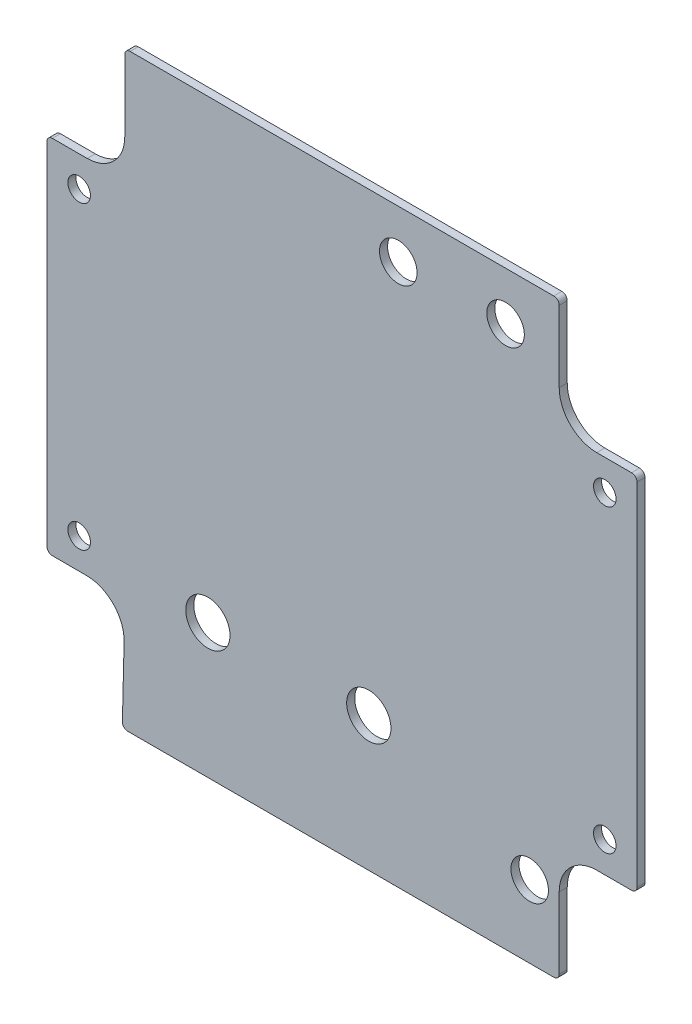
from build123d import *

# Parameters (mm, degrees)
EXTRUDE_1_DEPTH     = 1.5
HOLE_WIZARD_M4_1_D  = 4.2
HOLE_WIZARD_M8_1_D  = 8.25
SKETCH_8_R          = 3.5
CUT_EXTRUDE_1_DEPTH = 144.323608762
SKETCH_9_R          = 3.5
CUT_EXTRUDE_2_DEPTH = 144.323608762


with BuildPart() as part:
    # 草圖1 → 填料-伸長1 (new body)
    with BuildSketch(Plane.XY):
        with BuildLine():
            Line((9.519190028, -18.946187519), (9.519190028, -5.659090909))
            ThreePointArc((9.519190028, -5.659090909), (9.226296809, -4.951984128), (8.519190028, -4.659090909))
            Line((8.519190028, -4.659090909), (-70.48081017, -4.659090909))
            ThreePointArc((-70.48081017, -4.659090909), (-71.187916951, -4.951984128), (-71.48081017, -5.659090909))
            Line((-71.48081017, -5.659090909), (-71.48081017, -18.946187519))
            ThreePointArc((-71.48081017, -18.946187519), (-73.531062702, -23.895934988), (-78.48081017, -25.946187519))
            Line((-78.48081017, -25.946187519), (-84.980810071, -25.946187519))
            ThreePointArc((-84.980810071, -25.946187519), (-85.687916853, -26.239080738), (-85.980810071, -26.946187519))
            Line((-85.980810071, -26.946187519), (-85.980810071, -92.341911374))
            ThreePointArc((-85.980810071, -92.341911374), (-85.688840793, -93.048093006), (-84.983425077, -93.341907955))
            Line((-84.983425077, -93.341907955), (-78.583599692, -93.358643592))
            ThreePointArc((-78.583599692, -93.358643592), (-73.586751521, -95.475153852), (-71.603919064, -100.526538095))
            Line((-71.603919064, -100.526538095), (-71.918462387, -113.635102561))
            ThreePointArc((-71.918462387, -113.635102561), (-71.634287831, -114.357665047), (-70.918750149, -114.659090909))
            Line((-70.918750149, -114.659090909), (8.519190028, -114.659090909))
            ThreePointArc((8.519190028, -114.659090909), (9.226296809, -114.36619769), (9.519190028, -113.659090909))
            Line((9.519190028, -113.659090909), (9.519190028, -100.371994299))
            ThreePointArc((9.519190028, -100.371994299), (11.569442559, -95.422246831), (16.519190028, -93.371994299))
            Line((16.519190028, -93.371994299), (23.019189929, -93.371994299))
            ThreePointArc((23.019189929, -93.371994299), (23.72629671, -93.07910108), (24.019189929, -92.371994299))
            Line((24.019189929, -92.371994299), (24.019189929, -26.946187519))
            ThreePointArc((24.019189929, -26.946187519), (23.72629671, -26.239080738), (23.019189929, -25.946187519))
            Line((23.019189929, -25.946187519), (16.519190028, -25.946187519))
            ThreePointArc((16.519190028, -25.946187519), (11.569442559, -23.895934988), (9.519190028, -18.946187519))
        make_face()
    extrude(amount=EXTRUDE_1_DEPTH)

    # M4 螺旋的螺孔鑽1 (through all)
    with Locations(Plane(origin=(0, 0, 0), x_dir=(-1, 0, 0), z_dir=(0, 0, -1))):
        with Locations((79.980810071, -87.644049447), (-18.019189929, -87.644049447), (-18.019189929, -31.644049447), (79.980810071, -31.644049447)):
            Hole(HOLE_WIZARD_M4_1_D / 2)

    # M8 螺旋的螺孔鑽1 (through all)
    with Locations(Plane.XY.offset(1.5)):
        with Locations((-55.980810071, -89.659090909), (-25.980810071, -89.659090909)):
            Hole(HOLE_WIZARD_M8_1_D / 2)

    # 草圖8 → 除料-伸長1 (cut, through all)
    with BuildSketch(Plane.XY.offset(1.5)):
        with Locations((4.019190028, -101.159090909)):
            Circle(SKETCH_8_R)
    extrude(amount=-CUT_EXTRUDE_1_DEPTH, mode=Mode.SUBTRACT)

    # 草圖9 → 除料-伸長2 (cut, through all)
    with BuildSketch(Plane.XY.offset(1.5)):
        with Locations((-0.480809972, -13.659090909)):
            Circle(SKETCH_9_R)
        with Locations((-20.480809972, -13.659090909)):
            Circle(SKETCH_9_R)
    extrude(amount=-CUT_EXTRUDE_2_DEPTH, mode=Mode.SUBTRACT)


solid = part.part
